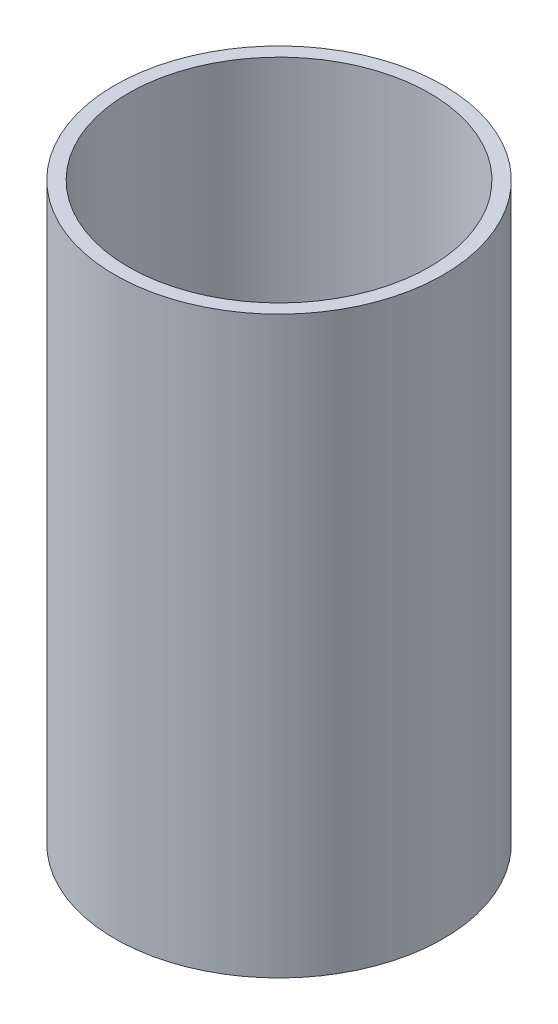
from build123d import *

# Parameters (mm, degrees)
SKETCH1_R           = 12
BOSS_EXTRUDE1_DEPTH = 42
CUT_EXTRUDE1_REACH  = 47.299
SKETCH2_R           = 11


with BuildPart() as part:
    # Sketch1 → Boss-Extrude1 (new body)
    with BuildSketch(Plane(origin=(0, 0, 0), x_dir=(1, 0, 0), z_dir=(0, 1, 0))):
        with Locations(Location((0, 0, 0), (0, 0, 90))):
            Circle(SKETCH1_R)
    extrude(amount=BOSS_EXTRUDE1_DEPTH)

    # Sketch2 → Cut-Extrude1 (cut, up to next)
    with BuildSketch(Plane(origin=(0, 42, 0), x_dir=(1, 0, 0), z_dir=(0, 1, 0)), mode=Mode.PRIVATE) as cut_extrude1_sk1:
        with Locations(Location((0, 0, 0), (0, 0, 270))):
            Circle(SKETCH2_R)
    cut_extrude1_tool1 = extrude(cut_extrude1_sk1.sketch, amount=-CUT_EXTRUDE1_REACH, mode=Mode.PRIVATE) & part.part
    add(cut_extrude1_tool1.solids().sort_by_distance((0, 42, 0))[0], mode=Mode.SUBTRACT)


solid = part.part
